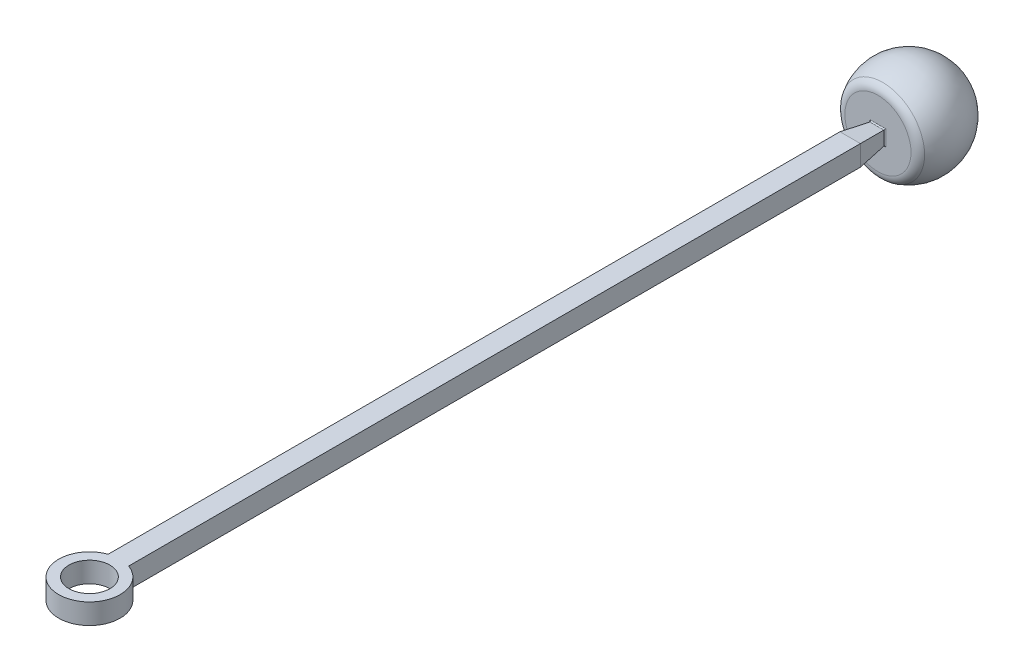
from build123d import *

# Parameters (mm, degrees)
SKETCH2_W           = 10
SKETCH2_H           = 10
BOSS_EXTRUDE1_DEPTH = 400
SKETCH3_R           = 15
BOSS_EXTRUDE2_DEPTH = 10
SKETCH4_R           = 10
CUT_EXTRUDE1_DEPTH  = 10
CUT_EXTRUDE2_START  = 15
SKETCH5_OUTSIDE_W   = 237.072
SKETCH5_OUTSIDE_H   = 237.072
SKETCH5_OUTSIDE_W_2 = 6.67
SKETCH5_OUTSIDE_H_2 = 6.67
CUT_EXTRUDE2_DEPTH  = 400
CUT_EXTRUDE2_TAPER  = 7
FILLET1_R           = 0.5
FILLET2_R           = 5


with BuildPart() as part:
    # Sketch1 → Revolve1 (revolve)
    with BuildSketch(Plane.XY):
        with BuildLine():
            Line((0, 24), (0, -24))
            ThreePointArc((0, -24), (24, 0), (0, 24))
        make_face()
    revolve(axis=Axis((0, 24, 0), (0, -1, 0)))

    # Sketch2 → Boss-Extrude1 (add)
    with BuildSketch(Plane.XY):
        Rectangle(SKETCH2_W, SKETCH2_H)
    extrude(amount=BOSS_EXTRUDE1_DEPTH)

    # Sketch3 → Boss-Extrude2 (add)
    with BuildSketch(Plane(origin=(0, 5, 0), x_dir=(1, 0, 0), z_dir=(0, 1, 0))):
        with Locations((0, -400)):
            Circle(SKETCH3_R)
    extrude(amount=-BOSS_EXTRUDE2_DEPTH)

    # Sketch4 → Cut-Extrude1 (cut)
    with BuildSketch(Plane(origin=(0, 5, 0), x_dir=(1, 0, 0), z_dir=(0, 1, 0))):
        with Locations(Location((0, -400, 0), (0, 0, 270))):
            Circle(SKETCH4_R)
    extrude(amount=-CUT_EXTRUDE1_DEPTH, mode=Mode.SUBTRACT)

    # Sketch5 outside → Cut-Extrude2 (cut)
    with BuildSketch(Plane.XY.offset(CUT_EXTRUDE2_START)):
        Rectangle(SKETCH5_OUTSIDE_W, SKETCH5_OUTSIDE_H)
        Rectangle(SKETCH5_OUTSIDE_W_2, SKETCH5_OUTSIDE_H_2, mode=Mode.SUBTRACT)
    extrude(amount=CUT_EXTRUDE2_DEPTH, taper=CUT_EXTRUDE2_TAPER, mode=Mode.SUBTRACT)

    # Fillet1
    fillet1_edges = [part.edges().sort_by_distance(p)[0] for p in [
        (3.335, 0, 15),
        (0, 3.335, 15),
        (-3.335, 0, 15),
        (0, -3.335, 15),
    ]]
    fillet(fillet1_edges, radius=FILLET1_R)

    # Fillet2
    fillet2_edges = [part.edges().sort_by_distance(p)[0] for p in [
        (0, -18.734993995, 15),
    ]]
    fillet(fillet2_edges, radius=FILLET2_R)


solid = part.part
